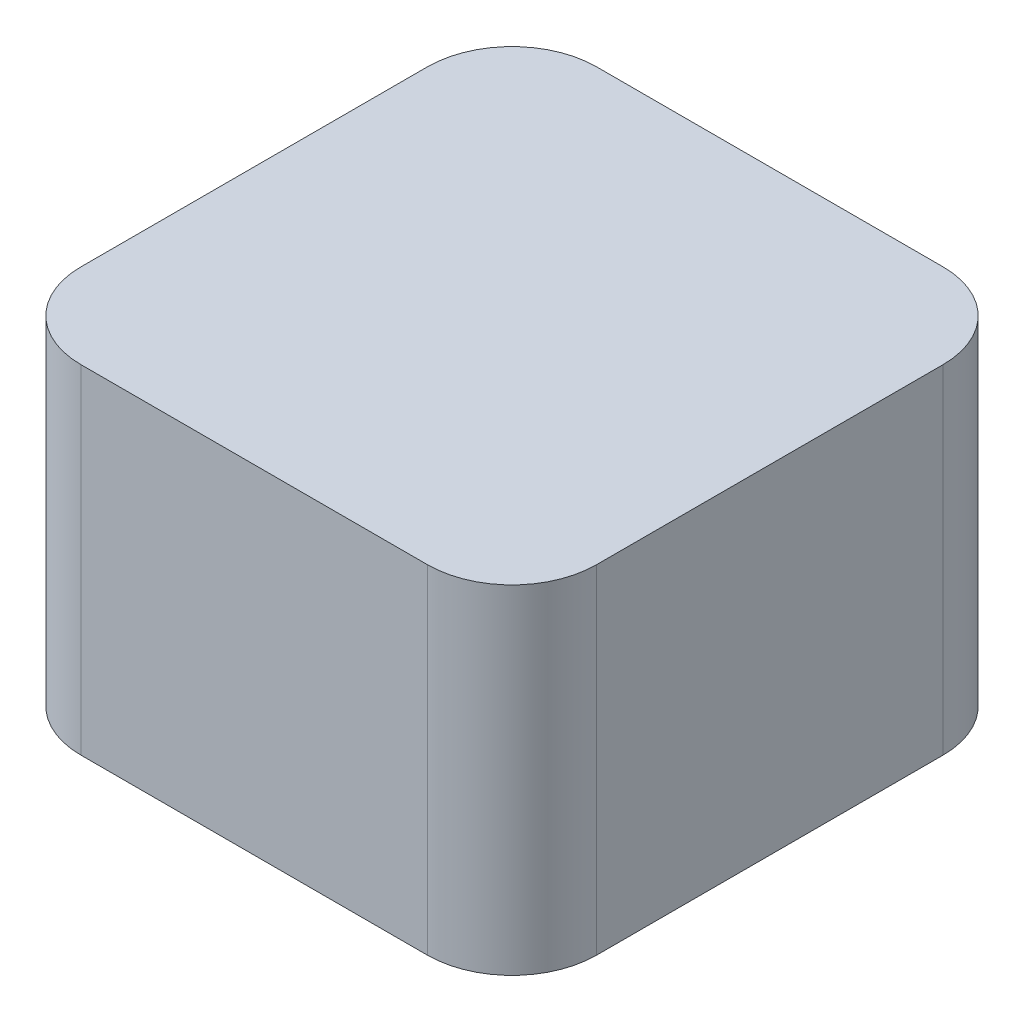
from build123d import *

# Parameters (mm, degrees)
BOSS_EXTRUDE1_DEPTH = 8


with BuildPart() as part:
    # Sketch1 → Boss-Extrude1 (new body)
    with BuildSketch(Plane(origin=(0, 0, 0), x_dir=(1, 0, 0), z_dir=(0, 1, 0))):
        with BuildLine():
            Line((-4.1, 6.1), (4.1, 6.1))
            ThreePointArc((4.1, 6.1), (5.514213562, 5.514213562), (6.1, 4.1))
            Line((6.1, 4.1), (6.1, -4.1))
            ThreePointArc((6.1, -4.1), (5.514213562, -5.514213562), (4.1, -6.1))
            Line((4.1, -6.1), (-4.1, -6.1))
            ThreePointArc((-4.1, -6.1), (-5.514213562, -5.514213562), (-6.1, -4.1))
            Line((-6.1, -4.1), (-6.1, 4.1))
            ThreePointArc((-6.1, 4.1), (-5.514213562, 5.514213562), (-4.1, 6.1))
        make_face()
    extrude(amount=BOSS_EXTRUDE1_DEPTH)


solid = part.part
